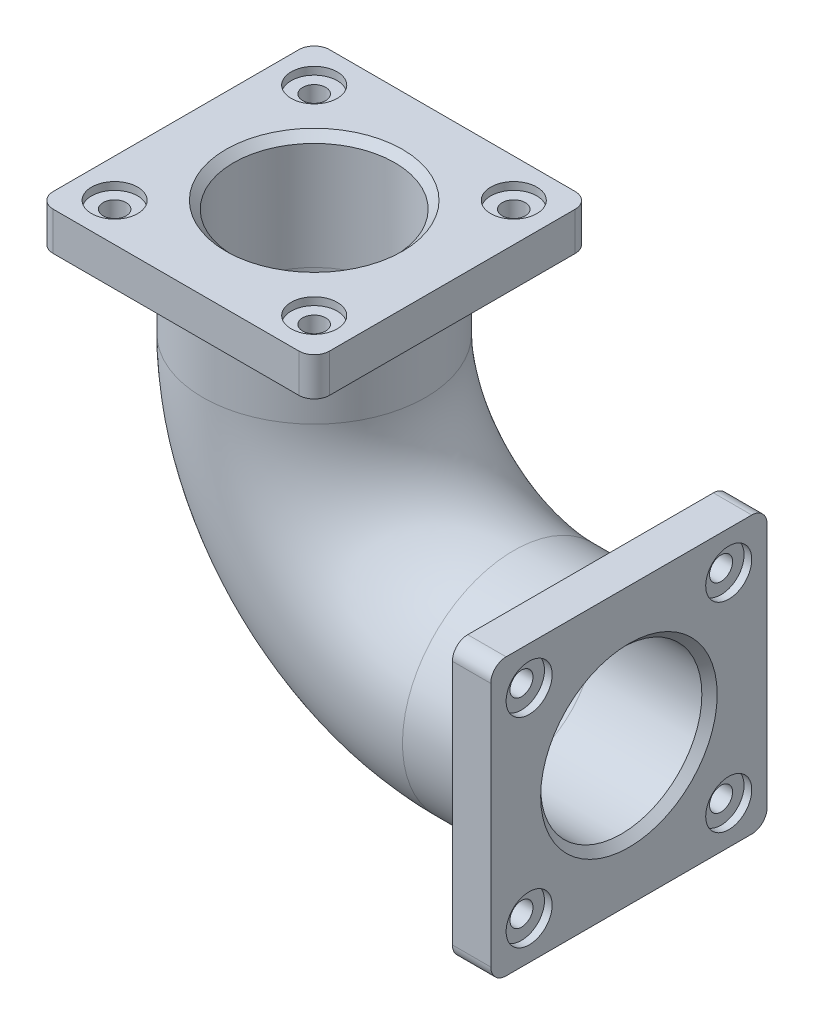
from build123d import *

# Parameters (mm, degrees)
SKETCH3_R           = 145
SKETCH3_R_2         = 105
BOSS_EXTRUDE1_START = -50
SKETCH4_W           = 360
SKETCH4_H           = 360
SKETCH4_R           = 145
BOSS_EXTRUDE1_DEPTH = 50
FILLET2_R           = 20
SKETCH5_W           = 360
SKETCH5_H           = 360
SKETCH5_R           = 145
BOSS_EXTRUDE2_DEPTH = 50
FILLET3_R           = 20
SKETCH6_R           = 30
CUT_EXTRUDE1_DEPTH  = 10
CUT_EXTRUDE2_REACH  = 734.735
SKETCH7_R           = 15
CIRPATTERN1_COUNT   = 4
SKETCH8_R           = 30
CUT_EXTRUDE3_DEPTH  = 10
CUT_EXTRUDE4_REACH  = 848.699
SKETCH9_R           = 15
CIRPATTERN2_COUNT   = 4
CHAMFER1_SIZE       = 10


with BuildPart() as part:
    # Sweep-Thin1: sweep along a path in Sketch2
    with BuildLine(Plane.XY) as sweep_thin1_path:
        Line((0, 0), (-150, 0))
        ThreePointArc((-150, 0), (-333.847763109, 76.152236891), (-410, 260))
        Line((-410, 260), (-410, 410))
    # Sketch3 → Sweep-Thin1 (sweep)
    with BuildSketch(Plane(origin=(0, 0, 0), x_dir=(0, 0, -1), z_dir=(1, 0, 0))):
        Circle(SKETCH3_R)
        Circle(SKETCH3_R_2, mode=Mode.SUBTRACT)
    sweep(path=sweep_thin1_path.line)

    # Sketch4 → Boss-Extrude1 (add)
    with BuildSketch(Plane(origin=(0, 0, 0), x_dir=(0, 0, -1), z_dir=(1, 0, 0)).offset(BOSS_EXTRUDE1_START)):
        Rectangle(SKETCH4_W, SKETCH4_H)
        with Locations(Location((0, 0, 0), (0, 0, 270))):
            Circle(SKETCH4_R, mode=Mode.SUBTRACT)
    extrude(amount=BOSS_EXTRUDE1_DEPTH)

    # Fillet2
    fillet2_edges = [part.edges().sort_by_distance(p)[0] for p in [
        (-25, 180, -180),
        (-25, -180, -180),
        (-25, -180, 180),
        (-25, 180, 180),
    ]]
    fillet(fillet2_edges, radius=FILLET2_R)

    # Sketch5 → Boss-Extrude2 (add)
    with BuildSketch(Plane(origin=(0, 410, 0), x_dir=(1, 0, 0), z_dir=(0, 1, 0))):
        with Locations((-410, 0)):
            Rectangle(SKETCH5_W, SKETCH5_H)
        with Locations(Location((-410, 0, 0), (0, 0, 270))):
            Circle(SKETCH5_R, mode=Mode.SUBTRACT)
    extrude(amount=-BOSS_EXTRUDE2_DEPTH)

    # Fillet3
    fillet3_edges = [part.edges().sort_by_distance(p)[0] for p in [
        (-230, 385, -180),
        (-230, 385, 180),
        (-590, 385, 180),
        (-590, 385, -180),
    ]]
    fillet(fillet3_edges, radius=FILLET3_R)

    # Sketch6 → Cut-Extrude1 (cut)
    with BuildSketch(Plane(origin=(0, 0, 0), x_dir=(0, 0, -1), z_dir=(1, 0, 0))):
        with Locations((-130, 130)):
            Circle(SKETCH6_R)
    cut_extrude1 = extrude(amount=-CUT_EXTRUDE1_DEPTH, mode=Mode.SUBTRACT)

    # Sketch7 → Cut-Extrude2 (cut, up to next)
    with BuildSketch(Plane(origin=(-10, 0, 0), x_dir=(0, 0, -1), z_dir=(1, 0, 0)), mode=Mode.PRIVATE) as cut_extrude2_sk1:
        with Locations((-130, 130)):
            Circle(SKETCH7_R)
    cut_extrude2_tool1 = extrude(cut_extrude2_sk1.sketch, amount=-CUT_EXTRUDE2_REACH, mode=Mode.PRIVATE) & part.part
    cut_extrude2 = cut_extrude2_tool1.solids().sort_by_distance((-10, 130, 130))[0]
    add(cut_extrude2, mode=Mode.SUBTRACT)

    # CirPattern1: Cut-Extrude1, Cut-Extrude2 ×4 about axis
    cirpattern1_axis = Axis((0, 0, 0), (1, 0, 0))
    add([cut_extrude1.rotate(cirpattern1_axis, i * 360 / CIRPATTERN1_COUNT) for i in range(1, CIRPATTERN1_COUNT)], mode=Mode.SUBTRACT)
    add([cut_extrude2.rotate(cirpattern1_axis, i * 360 / CIRPATTERN1_COUNT) for i in range(1, CIRPATTERN1_COUNT)], mode=Mode.SUBTRACT)

    # Sketch8 → Cut-Extrude3 (cut)
    with BuildSketch(Plane(origin=(0, 410, 0), x_dir=(1, 0, 0), z_dir=(0, 1, 0))):
        with Locations(Location((-540, 130, 0), (0, 0, 270))):
            Circle(SKETCH8_R)
    cut_extrude3 = extrude(amount=-CUT_EXTRUDE3_DEPTH, mode=Mode.SUBTRACT)

    # Sketch9 → Cut-Extrude4 (cut, up to next)
    with BuildSketch(Plane(origin=(0, 400, 0), x_dir=(1, 0, 0), z_dir=(0, 1, 0)), mode=Mode.PRIVATE) as cut_extrude4_sk1:
        with Locations(Location((-540, 130, 0), (0, 0, 270))):
            Circle(SKETCH9_R)
    cut_extrude4_tool1 = extrude(cut_extrude4_sk1.sketch, amount=-CUT_EXTRUDE4_REACH, mode=Mode.PRIVATE) & part.part
    cut_extrude4 = cut_extrude4_tool1.solids().sort_by_distance((-540, 400, -130))[0]
    add(cut_extrude4, mode=Mode.SUBTRACT)

    # CirPattern2: Cut-Extrude3, Cut-Extrude4 ×4 about axis
    cirpattern2_axis = Axis((-410, 0, 0), (0, 1, 0))
    add([cut_extrude3.rotate(cirpattern2_axis, i * 360 / CIRPATTERN2_COUNT) for i in range(1, CIRPATTERN2_COUNT)], mode=Mode.SUBTRACT)
    add([cut_extrude4.rotate(cirpattern2_axis, i * 360 / CIRPATTERN2_COUNT) for i in range(1, CIRPATTERN2_COUNT)], mode=Mode.SUBTRACT)

    # Chamfer1
    chamfer1_edges = [part.edges().sort_by_distance(p)[0] for p in [
        (0, 0, 105),
        (-410, 410, 105),
    ]]
    chamfer(chamfer1_edges, length=CHAMFER1_SIZE)


solid = part.part
